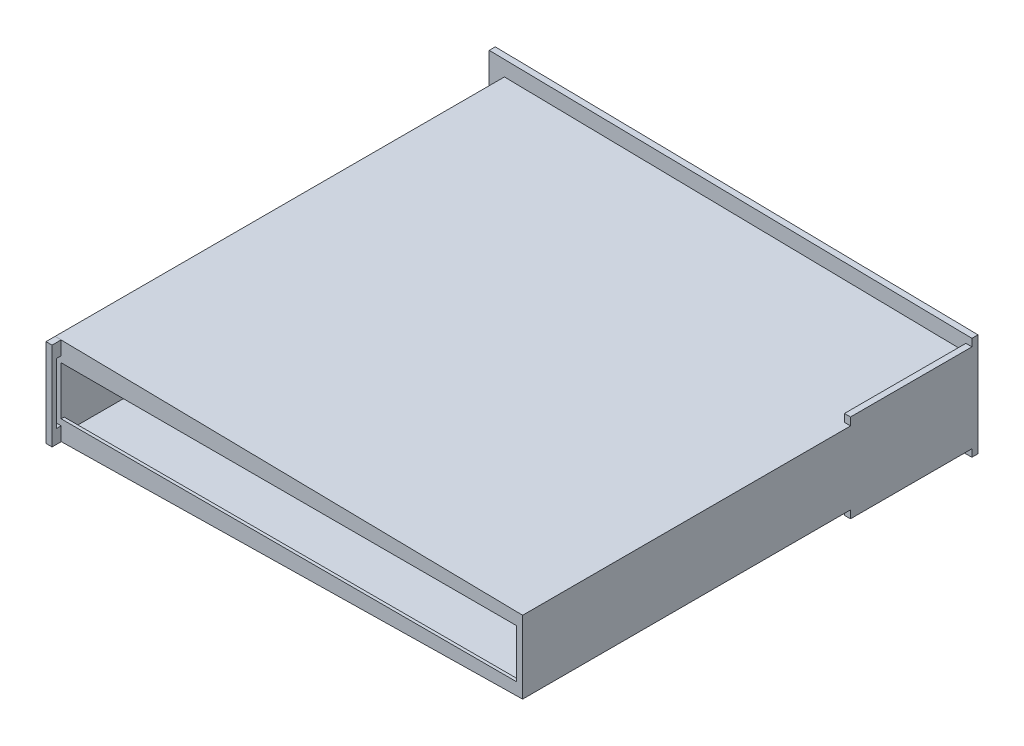
from build123d import *

# Parameters (mm, degrees)
BOSS_EXTRUDE1_DEPTH   = 150
BOSS_EXTRUDE3_DEPTH   = 1
BOSS_EXTRUDE3_2_DEPTH = 1
BOSS_EXTRUDE5_DEPTH   = 2
BOSS_EXTRUDE6_DEPTH   = 2
SKETCH8_W             = 40
SKETCH8_H             = 2.566666667
BOSS_EXTRUDE7_DEPTH   = 2


with BuildPart() as part:
    # Sketch1 → Boss-Extrude1 (new body)
    with BuildSketch(Plane.XY):
        Polygon((152, 0.533055575), (152, 24.466944425), (-2, 27.033611092), (-2, -2.033611092), align=None)
        Polygon((150, 22.5), (0, 25), (0, 0), (150, 2.5), align=None, mode=Mode.SUBTRACT)
    extrude(amount=BOSS_EXTRUDE1_DEPTH)



with BuildPart() as body_2:
    # Sketch3 → Boss-Extrude3 (new body)
    with BuildSketch(Plane.XY.offset(150)):
        Polygon((0, 20.5), (150, 20.5), (150, 22.5), (0, 25), align=None)
    extrude(amount=-BOSS_EXTRUDE3_DEPTH)


with BuildPart() as body_3:
    # Sketch3 → Boss-Extrude3 2 (new body)
    with BuildSketch(Plane.XY.offset(150)):
        Polygon((150, 2.5), (150, 4.5), (0, 4.5), (0, 0), align=None)
    extrude(amount=-BOSS_EXTRUDE3_2_DEPTH)


with BuildPart() as part_1:
    add(part.part)

    add(body_2.part)  # Boss-Extrude5 merges body 2

    add(body_3.part)  # Boss-Extrude5 merges body 3
    # Sketch6 → Boss-Extrude5 (add)
    with BuildSketch(Plane.ZY.offset(2)):
        Polygon((150, 22.5), (151.5, 22.5), (151.5, 2.5), (150, 2.5), (150, -2.033611092), (153, -2.033611092), (153, 27.033611092), (150, 27.033611092), align=None)
    extrude(amount=-BOSS_EXTRUDE5_DEPTH)

    # Sketch7 → Boss-Extrude6 (add)
    with BuildSketch(Plane(origin=(0, 0, 0), x_dir=(-1, 0, 0), z_dir=(0, 0, -1))):
        Polygon((-152, -4.467638821), (7, -7.117638821), (7, 32.117638821), (-152, 29.467638821), (-152, 24.466944425), (2, 27.033611092), (2, -2.033611092), (-152, 0.533055575), align=None)
    extrude(amount=-BOSS_EXTRUDE6_DEPTH)

    # Sketch8 → Boss-Extrude7 (add)
    with BuildSketch(Plane(origin=(152, 0, 0), x_dir=(0, 0, -1), z_dir=(1, 0, 0))):
        with Locations((-22, 25.750277759)):
            Rectangle(SKETCH8_W, SKETCH8_H)
        with Locations((-22, -0.750277759)):
            Rectangle(SKETCH8_W, SKETCH8_H)
    extrude(amount=-BOSS_EXTRUDE7_DEPTH)


solid = part_1.part
